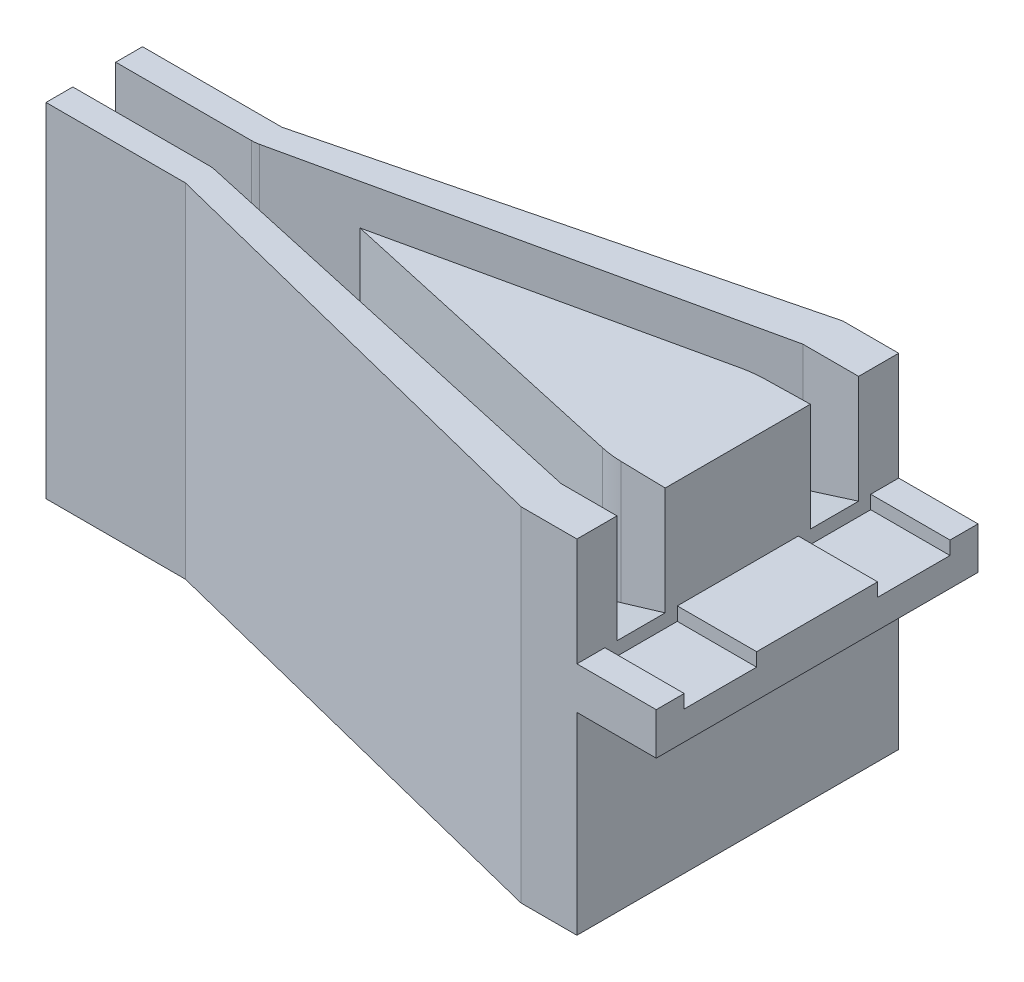
from build123d import *

# Parameters (mm, degrees)
SKETCH1_W           = 152.4
SKETCH1_H           = 76.2
BOSS_EXTRUDE1_DEPTH = 81.28
CUT_EXTRUDE1_DEPTH  = 73.66
SKETCH4_W           = 177.8
SKETCH4_H           = 76.2
REVOLVE1_ANGLE      = 17.5
CUT_EXTRUDE2_DEPTH  = 136.575102434
SKETCH5_W           = 25.4
SKETCH5_H           = 76.2
CUT_EXTRUDE3_DEPTH  = 45.72
FILLET1_R           = 7.62
FILLET2_R           = 25.4
SKETCH7_W           = 21.387890157
SKETCH7_H           = 5.413955727
CUT_EXTRUDE5_DEPTH  = 149.031271926
SKETCH8_W           = 2.486098051
SKETCH8_H           = 76.2
CUT_EXTRUDE6_DEPTH  = 119.538217147
SKETCH9_W           = 18.783789955
SKETCH9_H           = 17.145
CUT_EXTRUDE7_DEPTH  = 3.175


with BuildPart() as part:
    # Sketch1 → Boss-Extrude1 (new body)
    with BuildSketch(Plane(origin=(0, 0, 0), x_dir=(1, 0, 0), z_dir=(0, 1, 0))):
        Rectangle(SKETCH1_W, SKETCH1_H)
    extrude(amount=BOSS_EXTRUDE1_DEPTH)

    # Sketch2 → Cut-Extrude1 (cut)
    with BuildSketch(Plane(origin=(0, 81.28, 0), x_dir=(1, 0, 0), z_dir=(0, 1, 0))):
        Polygon((-76.2, 0), (-76.2, 5.08), (-43.18, 5.08), (62.978326754, 28.614734436), (76.2, 28.614734436), (76.2, 17.184734436), (62.978326754, 16.907219588), (-13.285212414, 0), (62.978326754, -16.907219588), (76.2, -17.184734436), (76.2, -28.614734436), (62.978326754, -28.614734436), (-43.18, -5.08), (-76.2, -5.08), align=None)
    extrude(amount=-CUT_EXTRUDE1_DEPTH, mode=Mode.SUBTRACT)

    # Sketch4 → Revolve1 (revolve)
    with BuildSketch(Plane(origin=(0, 7.62, 0), x_dir=(-1, 0, 0), z_dir=(0, -1, 0))):
        with Locations((-12.7, 0)):
            Rectangle(SKETCH4_W, SKETCH4_H)
    revolve(axis=Axis((-76.2, 7.62, 38.1), (0, 0, 1)), revolution_arc=REVOLVE1_ANGLE)

    # Sketch3 → Cut-Extrude2 (cut, through all)
    with BuildSketch(Plane(origin=(0, 81.28, 0), x_dir=(1, 0, 0), z_dir=(0, 1, 0))):
        Polygon((62.978326754, 38.1), (-76.2, 38.1), (-76.2, 11.43), (-43.18, 11.43), align=None)
        Polygon((-76.2, -11.43), (-43.18, -11.43), (62.978326754, -38.1), (-76.2, -38.1), align=None)
    extrude(amount=-CUT_EXTRUDE2_DEPTH, mode=Mode.SUBTRACT)

    # Sketch5 → Cut-Extrude3 (cut)
    with BuildSketch(Plane(origin=(0, 0, 0), x_dir=(-1, 0, 0), z_dir=(0, -1, 0))):
        with Locations((-88.9, 0)):
            Rectangle(SKETCH5_W, SKETCH5_H)
    extrude(amount=-CUT_EXTRUDE3_DEPTH, mode=Mode.SUBTRACT)

    # Fillet1
    fillet1_edges = [part.edges().sort_by_distance(p)[0] for p in [
        (-43.18, 49.655583004, 5.08),
        (-43.18, 49.655583004, -5.08),
    ]]
    fillet(fillet1_edges, radius=FILLET1_R)

    # Fillet2
    fillet2_edges = [part.edges().sort_by_distance(p)[0] for p in [
        (62.978326754, 66.391378932, 16.907219588),
        (62.978326754, 66.391378932, -16.907219588),
    ]]
    fillet(fillet2_edges, radius=FILLET2_R)

    # Sketch7 → Cut-Extrude5 (cut, through all)
    with BuildSketch(Plane.XY.offset(38.1)):
        with Locations((86.893945078, 58.378513289)):
            Rectangle(SKETCH7_W, SKETCH7_H)
    extrude(amount=-CUT_EXTRUDE5_DEPTH, mode=Mode.SUBTRACT)

    # Sketch8 → Cut-Extrude6 (cut, through all)
    with BuildSketch(Plane(origin=(0, 55.671535425, 0), x_dir=(1, 0, 0), z_dir=(0, 1, 0))):
        with Locations((96.226838981, 0)):
            Rectangle(SKETCH8_W, SKETCH8_H)
    extrude(amount=-CUT_EXTRUDE6_DEPTH, mode=Mode.SUBTRACT)

    # Sketch9 → Cut-Extrude7 (cut)
    with BuildSketch(Plane(origin=(0, 55.671535425, 0), x_dir=(1, 0, 0), z_dir=(0, 1, 0))):
        with Locations((85.591894978, 22.899734436)):
            Rectangle(SKETCH9_W, SKETCH9_H)
        with Locations((85.591894978, -22.899734436)):
            Rectangle(SKETCH9_W, SKETCH9_H)
    extrude(amount=-CUT_EXTRUDE7_DEPTH, mode=Mode.SUBTRACT)


solid = part.part
